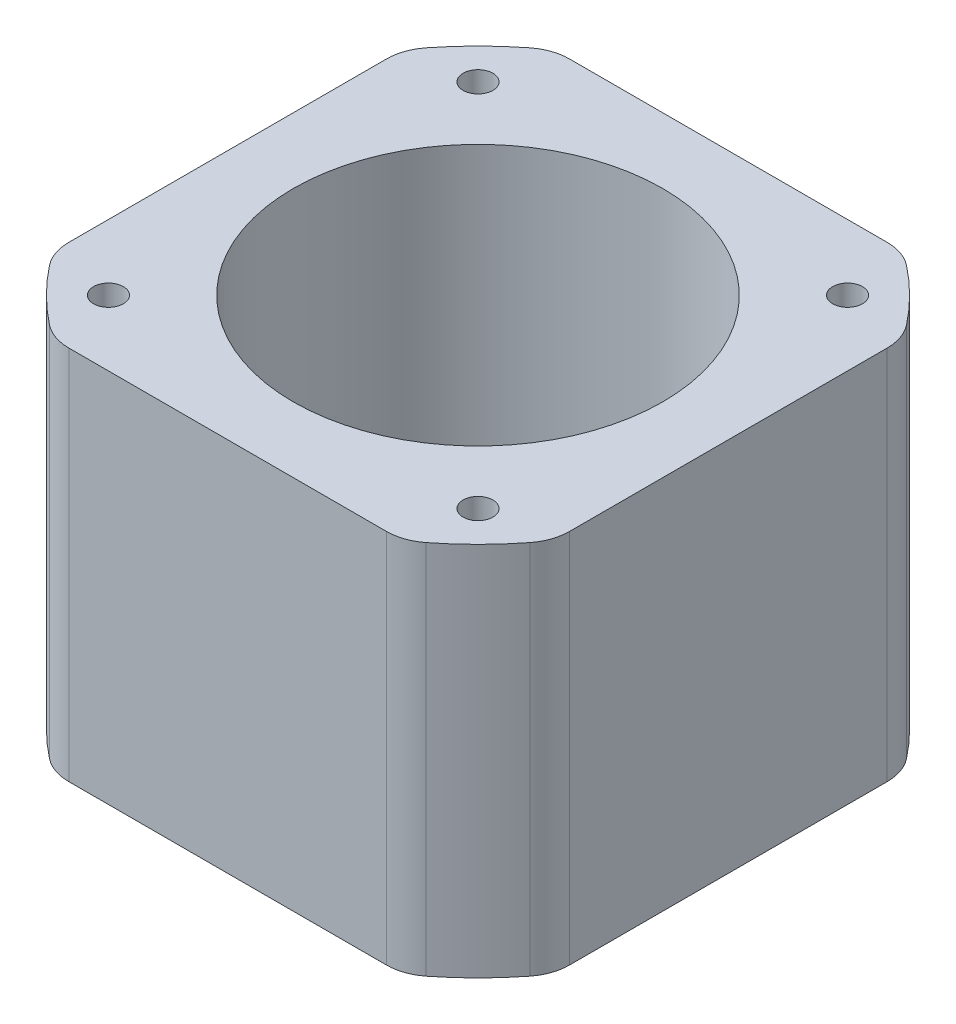
from build123d import *

# Parameters (mm, degrees)
SKETCH_1_R      = 1.25
SKETCH_1_R_2    = 15.5
EXTRUDE_1_DEPTH = 31.5
FILLET_1_R      = 4


with BuildPart() as part:
    # Эскиз1 → Бобышка-Вытянуть1 (new body)
    with BuildSketch(Plane(origin=(0, 0, 0), x_dir=(1, 0, 0), z_dir=(0, 1, 0))):
        with BuildLine():
            Line((-14.641038215, -21), (14.641038215, -21))
            ThreePointArc((14.641038215, -21), (18.101933598, -18.101933598), (21, -14.641038215))
            Line((21, -14.641038215), (21, 14.641038215))
            ThreePointArc((21, 14.641038215), (18.101933598, 18.101933598), (14.641038215, 21))
            Line((14.641038215, 21), (-14.641038215, 21))
            ThreePointArc((-14.641038215, 21), (-18.101933598, 18.101933598), (-21, 14.641038215))
            Line((-21, 14.641038215), (-21, -14.641038215))
            ThreePointArc((-21, -14.641038215), (-18.101933598, -18.101933598), (-14.641038215, -21))
        make_face()
        with Locations(Location((-15.5, 15.5, 0), (0, 0, 270))):
            Circle(SKETCH_1_R, mode=Mode.SUBTRACT)
        with Locations(Location((15.5, 15.5, 0), (0, 0, 270))):
            Circle(SKETCH_1_R, mode=Mode.SUBTRACT)
        with Locations(Location((15.5, -15.5, 0), (0, 0, 270))):
            Circle(SKETCH_1_R, mode=Mode.SUBTRACT)
        with Locations(Location((-15.5, -15.5, 0), (0, 0, 270))):
            Circle(SKETCH_1_R, mode=Mode.SUBTRACT)
        with Locations(Location((0, 0, 0), (0, 0, 270))):
            Circle(SKETCH_1_R_2, mode=Mode.SUBTRACT)
    extrude(amount=EXTRUDE_1_DEPTH)

    # Скругление1
    fillet_1_edges = [part.edges().sort_by_distance(p)[0] for p in [
        (21, 15.75, -14.641038215),
        (21, 15.75, 14.641038215),
        (14.641038215, 15.75, 21),
        (-14.641038215, 15.75, 21),
        (-21, 15.75, 14.641038215),
        (-21, 15.75, -14.641038215),
        (-14.641038215, 15.75, -21),
        (14.641038215, 15.75, -21),
    ]]
    fillet(fillet_1_edges, radius=FILLET_1_R)


solid = part.part
